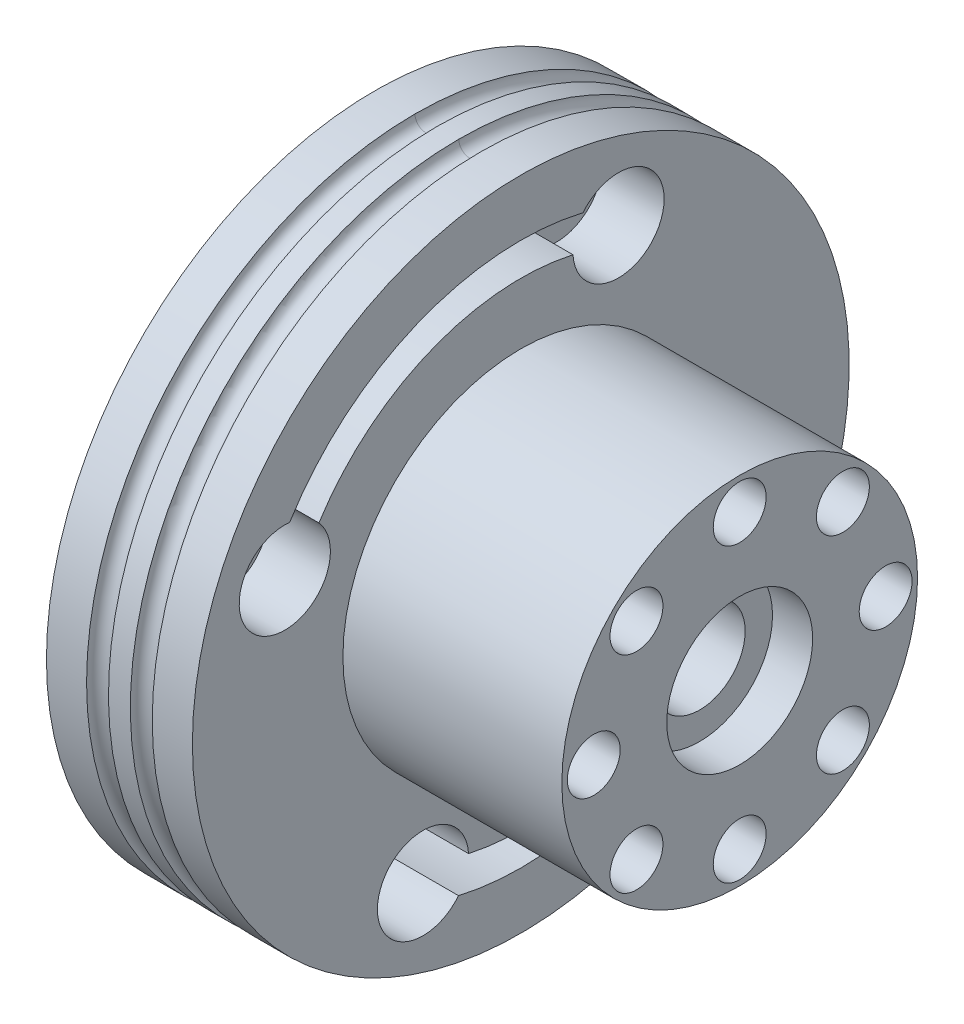
from build123d import *

# Parameters (mm, degrees)
SKETCH1_R                                       = 9.75
BOSS_EXTRUDE1_DEPTH                             = 20
SKETCH3_R                                       = 4
CUT_EXTRUDE1_DEPTH                              = 2.2
SKETCH5_R                                       = 18
BOSS_EXTRUDE3_DEPTH                             = 8
CBORE_FOR_M2_5_CHEESE_SLOTTED_HEAD2_D           = 2.9
CBORE_FOR_M2_5_CHEESE_SLOTTED_HEAD2_CBORE_D     = 5.5
CBORE_FOR_M2_5_CHEESE_SLOTTED_HEAD2_CBORE_DEPTH = 1.8
SKETCH4_R                                       = 2.5
CUT_EXTRUDE2_DEPTH                              = 3
SKETCH12_R                                      = 0.6
CUT_EXTRUDE3_START                              = -3.4
CUT_EXTRUDE3_DEPTH                              = 3.4
CUT_EXTRUDE4_START                              = -5.8
CUT_EXTRUDE4_DEPTH                              = 5.8
M2_TAPPED_HOLE2_D                               = 1.6
M2_TAPPED_HOLE3_D                               = 1.6
SKETCH27_R                                      = 0.6
SKETCH31_R                                      = 0.6


with BuildPart() as part:
    # Sketch1 → Boss-Extrude1 (new body)
    with BuildSketch(Plane(origin=(0, 0, 0), x_dir=(0, 0, -1), z_dir=(1, 0, 0))):
        Circle(SKETCH1_R)
    extrude(amount=BOSS_EXTRUDE1_DEPTH)

    # Sketch3 → Cut-Extrude1 (cut)
    with BuildSketch(Plane(origin=(20, 0, 0), x_dir=(0, 0, -1), z_dir=(1, 0, 0))):
        Circle(SKETCH3_R)
    extrude(amount=-CUT_EXTRUDE1_DEPTH, mode=Mode.SUBTRACT)

    # Sketch5 → Boss-Extrude3 (add)
    with BuildSketch(Plane.ZY):
        Circle(SKETCH5_R)
    extrude(amount=-BOSS_EXTRUDE3_DEPTH)

    # CBORE for M2.5 Cheese Slotted Head2 (through all)
    with Locations(Plane(origin=(0, 0, -8), x_dir=(0, 0, -1), z_dir=(-1, 0, 0))):
        with Locations((0, 0), (-2.343145751, -5.656854249), (-8, -8), (-13.656854249, -5.656854249), (-16, 0), (-13.656854249, 5.656854249), (-8, 8), (-2.343145751, 5.656854249)):
            CounterBoreHole(CBORE_FOR_M2_5_CHEESE_SLOTTED_HEAD2_D / 2, CBORE_FOR_M2_5_CHEESE_SLOTTED_HEAD2_CBORE_D / 2, CBORE_FOR_M2_5_CHEESE_SLOTTED_HEAD2_CBORE_DEPTH)

    # Sketch4 → Cut-Extrude2 (cut)
    with BuildSketch(Plane(origin=(17.8, 0, 0), x_dir=(0, 0, -1), z_dir=(1, 0, 0))):
        Circle(SKETCH4_R)
    extrude(amount=-CUT_EXTRUDE2_DEPTH, mode=Mode.SUBTRACT)

    # Cut-Sweep1: sweep along a path in Sketch9
    with BuildLine(Plane(origin=(5.2, 0, 0), x_dir=(0, 0, -1), z_dir=(1, 0, 0))) as cut_sweep1_path:
        CenterArc((0, 0), 16, 0, 360)
    # Sketch12 → Cut-Sweep1 (sweep, cut)
    with BuildSketch(Plane.XY):
        with Locations((5.2, 18)):
            Circle(SKETCH12_R)
    cut_sweep1 = sweep(path=cut_sweep1_path.line, mode=Mode.SUBTRACT)

    # Mirror1: Cut-Sweep1 across plane
    add(cut_sweep1.mirror(Plane(origin=(4, 0, 0), x_dir=(0, 0, 1), z_dir=(1, 0, 0))), mode=Mode.SUBTRACT)

    # Sketch15 → Cut-Extrude3 (cut)
    with BuildSketch(Plane(origin=(8, 0, 0), x_dir=(0, 0, -1), z_dir=(1, 0, 0)).offset(CUT_EXTRUDE3_START)):
        with BuildLine():
            ThreePointArc((2.862120204, 12.783515477), (7.73896601, 12.173429909), (3.411868964, 14.504108045))
            ThreePointArc((3.411868964, 14.504108045), (-5.701983142, 13.765805034), (-12.668508834, 7.843397473))
            ThreePointArc((-12.668508834, 7.843397473), (-14.080190184, 3.135639494), (-11.063135085, 7.015485876))
            ThreePointArc((-11.063135085, 7.015485876), (-5.013152964, 12.102821876), (2.862120204, 12.783515477))
        make_face()
    extrude(amount=CUT_EXTRUDE3_DEPTH, mode=Mode.SUBTRACT)

    # Sketch17 → Cut-Extrude4 (cut)
    with BuildSketch(Plane(origin=(8, 0, 0), x_dir=(0, 0, -1), z_dir=(1, 0, 0)).offset(CUT_EXTRUDE4_START)):
        with BuildLine():
            ThreePointArc((-2.862120204, -12.783515477), (-7.73896601, -12.173429909), (-3.411868964, -14.504108045))
            ThreePointArc((-3.411868964, -14.504108045), (5.701983142, -13.765805034), (12.668508834, -7.843397473))
            ThreePointArc((12.668508834, -7.843397473), (14.080190184, -3.135639494), (11.063135085, -7.015485876))
            ThreePointArc((11.063135085, -7.015485876), (5.013152964, -12.102821876), (-2.862120204, -12.783515477))
        make_face()
    extrude(amount=CUT_EXTRUDE4_DEPTH, mode=Mode.SUBTRACT)

    # M2 Tapped Hole2 (through all)
    with Locations(Plane(origin=(4.6, 5.357568053, 12.934313455), x_dir=(0, 0, 1), z_dir=(1, 0, 0))):
        with Locations((0, 0), (-18.291881508, -7.576745402)):
            Hole(M2_TAPPED_HOLE2_D / 2)

    # M2 Tapped Hole3 (through all)
    with Locations(Plane(origin=(2.2, -12.934313455, 5.357568053), x_dir=(0, 0, 1), z_dir=(1, 0, 0))):
        with Locations((0, 0), (-18.291881508, -7.576745402)):
            Hole(M2_TAPPED_HOLE3_D / 2)

    # Cut-Sweep2: sweep along a path in Sketch26
    with BuildLine(Plane(origin=(5.2, 0, 0), x_dir=(0, 0, -1), z_dir=(1, 0, 0))) as cut_sweep2_path:
        ThreePointArc((5.357568053, 12.934313455), (11.480502971, 12.934313455), (15.810071772, 8.604744654))
    # Sketch27 → Cut-Sweep2 (sweep, cut)
    with BuildSketch(Plane(origin=(5.2, 8.604744654, -15.810071772), x_dir=(-1, 0, 0), z_dir=(0, -0.923879532511291, -0.38268343236508007))):
        Circle(SKETCH27_R)
    sweep(path=cut_sweep2_path.line, mode=Mode.SUBTRACT)

    # Cut-Sweep3: sweep along a path in Sketch29
    with BuildLine(Plane(origin=(2.8, 0, 0), x_dir=(0, 0, -1), z_dir=(1, 0, 0))) as cut_sweep3_path:
        ThreePointArc((17.263882256, 5.094935666), (17.263882256, -1.027999252), (12.934313455, -5.357568053))
    # Sketch31 → Cut-Sweep3 (sweep, cut)
    with BuildSketch(Plane(origin=(2.8, 5.094935666, -17.263882256), x_dir=(-1, 0, 0), z_dir=(0, -0.9238795325113144, -0.38268343236502306))):
        Circle(SKETCH31_R)
    sweep(path=cut_sweep3_path.line, mode=Mode.SUBTRACT)


solid = part.part
